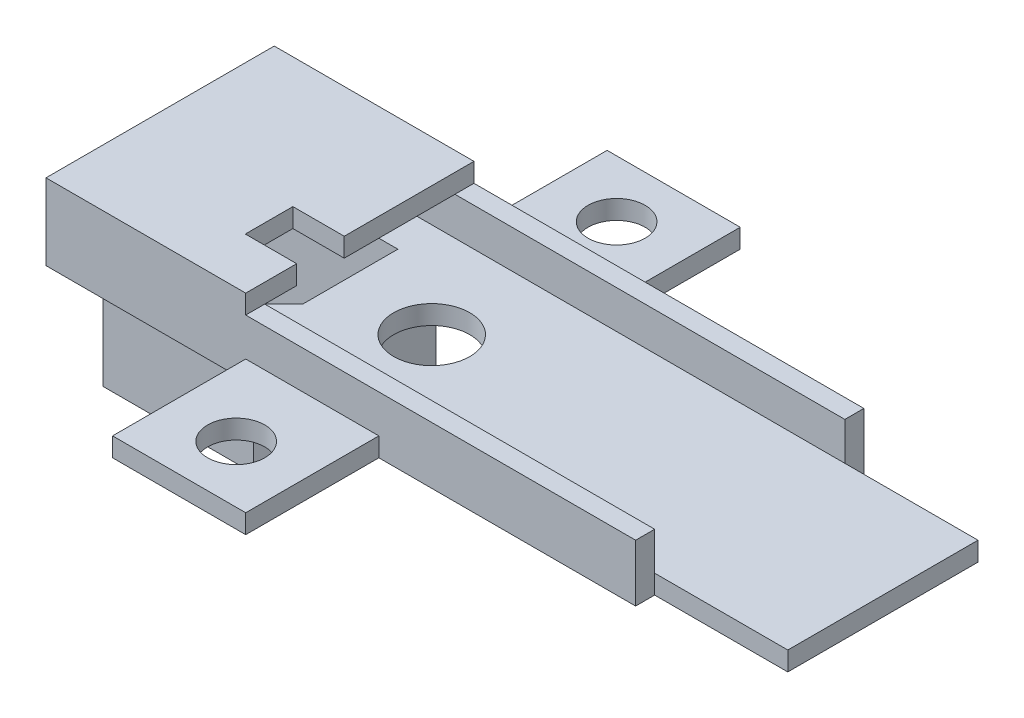
from build123d import *

# Parameters (mm, degrees)
EXTRUDE_1_DEPTH     = 1
EXTRUDE_2_DEPTH     = 6
SKETCH_3_R          = 2
CUT_EXTRUDE_1_DEPTH = 1
EXTRUDE_3_DEPTH     = 2
EXTRUDE_4_DEPTH     = 1
SKETCH_6_R          = 1.5
CUT_EXTRUDE_2_DEPTH = 1


with BuildPart() as part:
    # 草图1 → 凸台-拉伸1 (new body)
    with BuildSketch(Plane(origin=(0, 0, 0), x_dir=(1, 0, 0), z_dir=(0, 1, 0))):
        Polygon((23.47582205, -4.484524381), (23.47582205, -14.484524381), (16.47582205, -14.484524381), (16.47582205, -15.484524381), (2.97582205, -15.484524381), (2.97582205, -22.484524381), (-4.02417795, -22.484524381), (-4.02417795, -15.484524381), (-14.52417795, -15.484524381), (-14.52417795, -3.484524381), (-4.02417795, -3.484524381), (-4.02417795, 3.515475619), (2.97582205, 3.515475619), (2.97582205, -3.484524381), (16.47582205, -3.484524381), (16.47582205, -4.484524381), align=None)
        Polygon((-12.52417795, -6.484524381), (-12.52417795, -12.484524381), (-6.02417795, -12.484524381), (-5.02417795, -11.484524381), (-5.02417795, -6.484524381), align=None, mode=Mode.SUBTRACT)
    extrude(amount=EXTRUDE_1_DEPTH)

    # 草图2 → 凸台-拉伸2 (add)
    with BuildSketch(Plane.XZ):
        Polygon((-13.52417795, 5.484524381), (-13.52417795, 13.484524381), (-5.609964387, 13.484524381), (-4.02417795, 11.898737944), (-4.02417795, 5.484524381), align=None)
        Polygon((-12.52417795, 12.484524381), (-6.02417795, 12.484524381), (-5.02417795, 11.484524381), (-5.02417795, 6.484524381), (-12.52417795, 6.484524381), align=None, mode=Mode.SUBTRACT)
    extrude(amount=EXTRUDE_2_DEPTH)

    # 草图3 → 切除-拉伸1 (cut)
    with BuildSketch(Plane(origin=(0, 1, 0), x_dir=(1, 0, 0), z_dir=(0, 1, 0))):
        with Locations(Location((-0.24417795, -9.484524381, 0), (0, 0, 270))):
            Circle(SKETCH_3_R)
    extrude(amount=-CUT_EXTRUDE_1_DEPTH, mode=Mode.SUBTRACT)

    # 草图4 → 凸台-拉伸3 (add)
    with BuildSketch(Plane(origin=(0, 1, 0), x_dir=(1, 0, 0), z_dir=(0, 1, 0))):
        Polygon((-14.52417795, -3.484524381), (16.47582205, -3.484524381), (16.47582205, -4.484524381), (-13.52417795, -4.484524381), (-13.52417795, -14.484524381), (16.47582205, -14.484524381), (16.47582205, -15.484524381), (-14.52417795, -15.484524381), align=None)
    extrude(amount=EXTRUDE_3_DEPTH)

    # 草图5 → 凸台-拉伸4 (add)
    with BuildSketch(Plane(origin=(0, 3, 0), x_dir=(1, 0, 0), z_dir=(0, 1, 0))):
        Polygon((-14.52417795, -3.484524381), (-14.52417795, -15.484524381), (-4.02417795, -15.484524381), (-4.02417795, -12.804524381), (-6.72417795, -12.804524381), (-6.72417795, -10.304524381), (-4.02417795, -10.304524381), (-4.02417795, -3.484524381), align=None)
    extrude(amount=EXTRUDE_4_DEPTH)

    # 草图6 → 切除-拉伸2 (cut)
    with BuildSketch(Plane(origin=(0, 1, 0), x_dir=(1, 0, 0), z_dir=(0, 1, 0))):
        with Locations(Location((-0.52417795, 0.515475619, 0), (0, 0, 270))):
            Circle(SKETCH_6_R)
        with Locations(Location((-0.52417795, -19.484524381, 0), (0, 0, 90))):
            Circle(SKETCH_6_R)
    extrude(amount=-CUT_EXTRUDE_2_DEPTH, mode=Mode.SUBTRACT)


solid = part.part
